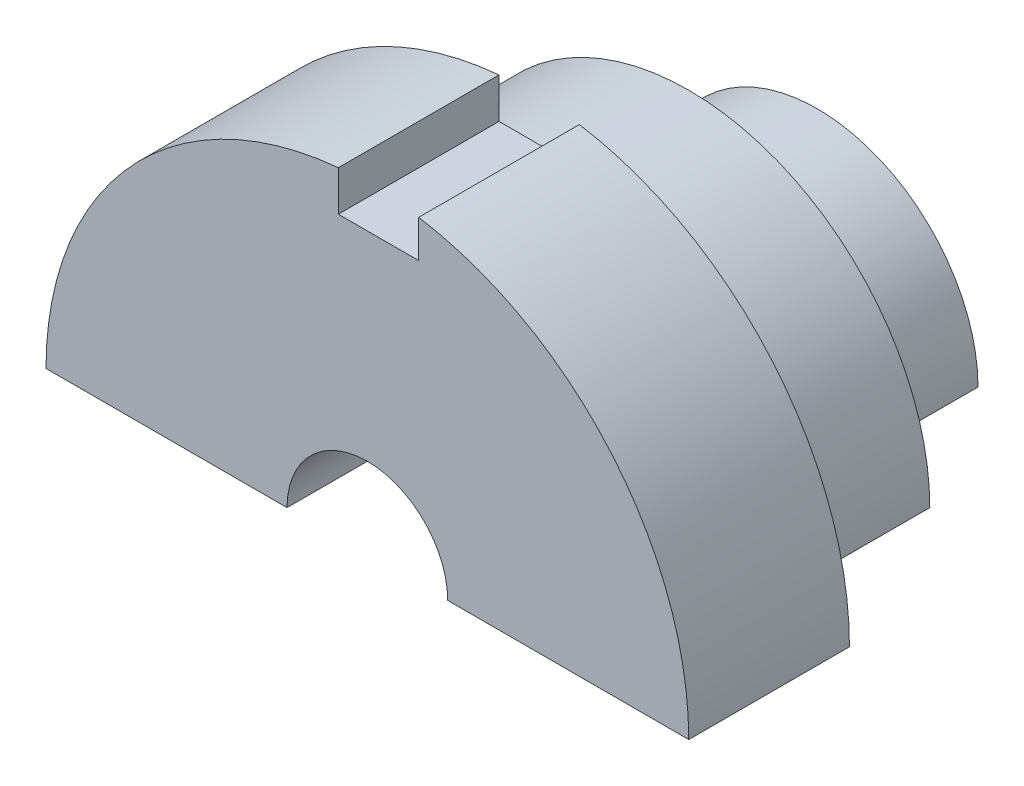
from build123d import *

# Parameters (mm, degrees)
BOSS_EXTRUDE1_DEPTH     = 10
CUT_EXTRUDE1_DEPTH      = 12
CUT_EXTRUDE1_DEPTH_BACK = 19
SKETCH3_W               = 5
SKETCH3_H               = 4.533190639
BOSS_EXTRUDE2_DEPTH     = 10
BOSS_EXTRUDE3_DEPTH     = 8
CUT_EXTRUDE3_DEPTH      = 41


with BuildPart() as part:
    # Sketch2 → Boss-Extrude1 (new body)
    with BuildSketch(Plane.XY):
        with BuildLine():
            Line((0, 0), (40, 0))
            ThreePointArc((40, 0), (20, 20), (0, 0))
        make_face()
    extrude(amount=BOSS_EXTRUDE1_DEPTH)

    # Sketch3 → Cut-Extrude1 (cut, two sides: drawn at the far end of the back side and taken through both)
    with BuildSketch(Plane.XY.offset(10).offset(-CUT_EXTRUDE1_DEPTH_BACK)):
        with Locations((20.692849678, 19.678974606)):
            Rectangle(SKETCH3_W, SKETCH3_H)
    extrude(amount=CUT_EXTRUDE1_DEPTH + CUT_EXTRUDE1_DEPTH_BACK, mode=Mode.SUBTRACT)

    # Sketch4 → Boss-Extrude2 (add)
    with BuildSketch(Plane(origin=(0, 0, 0), x_dir=(-1, 0, 0), z_dir=(0, 0, -1))):
        with BuildLine():
            Line((-35, 0), (-5, 0))
            ThreePointArc((-5, 0), (-20, 15), (-35, 0))
        make_face()
    extrude(amount=BOSS_EXTRUDE2_DEPTH)

    # Sketch5 → Boss-Extrude3 (add)
    with BuildSketch(Plane(origin=(0, 0, -10), x_dir=(-1, 0, 0), z_dir=(0, 0, -1))):
        with BuildLine():
            Line((-30, 0), (-10, 0))
            ThreePointArc((-10, 0), (-20, 10), (-30, 0))
        make_face()
    extrude(amount=BOSS_EXTRUDE3_DEPTH)

    # Sketch6 → Cut-Extrude3 (cut)
    with BuildSketch(Plane(origin=(0, 0, -18), x_dir=(-1, 0, 0), z_dir=(0, 0, -1))):
        with BuildLine():
            Line((-25, 0), (-15, 0))
            ThreePointArc((-15, 0), (-20, 5), (-25, 0))
        make_face()
    extrude(amount=-CUT_EXTRUDE3_DEPTH, mode=Mode.SUBTRACT)


solid = part.part
